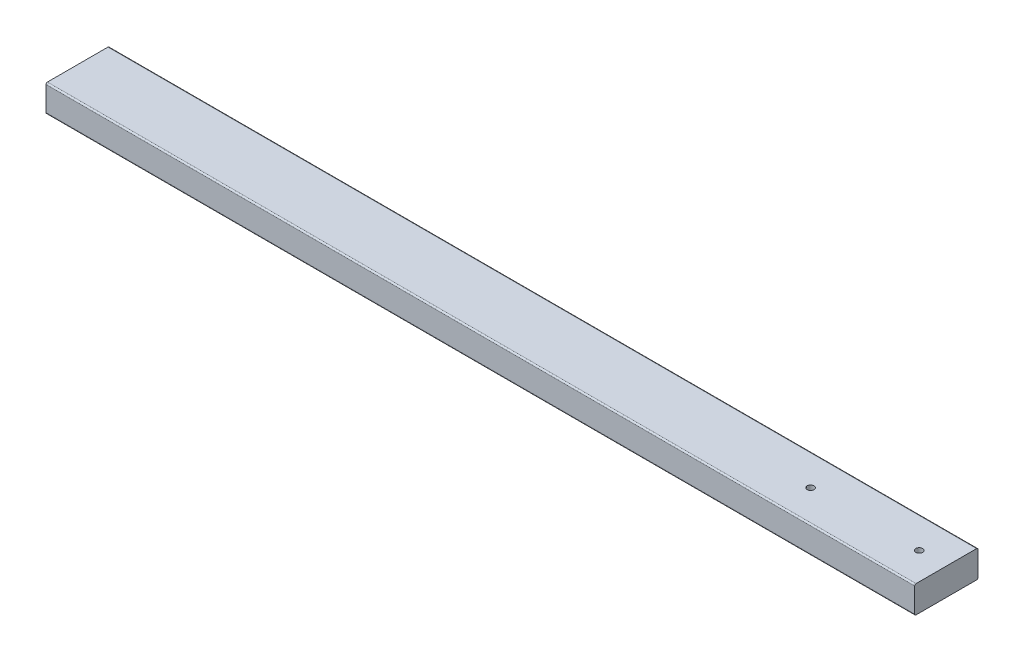
from build123d import *

# Parameters (mm, degrees)
SKETCH1_W           = 88.9
SKETCH1_H           = 38.1
BOSS_EXTRUDE1_DEPTH = 1219.2
FILLET1_R           = 2
SKETCH2_R           = 4.7625
CUT_EXTRUDE1_DEPTH  = 1221.604789643


with BuildPart() as part:
    # Sketch1 → Boss-Extrude1 (new body)
    with BuildSketch(Plane(origin=(0, 609.6, 0), x_dir=(0, 0, -1), z_dir=(1, 0, 0))):
        with Locations((0, -609.6)):
            Rectangle(SKETCH1_W, SKETCH1_H)
    extrude(amount=BOSS_EXTRUDE1_DEPTH)

    # Fillet1
    fillet1_edges = [part.edges().sort_by_distance(p)[0] for p in [
        (609.6, -19.05, -44.45),
        (609.6, -19.05, 44.45),
        (609.6, 19.05, 44.45),
        (609.6, 19.05, -44.45),
    ]]
    fillet(fillet1_edges, radius=FILLET1_R)

    # Sketch2 → Cut-Extrude1 (cut, through all)
    with BuildSketch(Plane(origin=(0, -19.05, 0), x_dir=(-1, 0, 0), z_dir=(0, -1, 0))):
        with Locations(Location((-1028.7, 0, 0), (0, 0, 90))):
            Circle(SKETCH2_R)
        with Locations(Location((-1181.1, 0, 0), (0, 0, 90))):
            Circle(SKETCH2_R)
    extrude(amount=-CUT_EXTRUDE1_DEPTH, mode=Mode.SUBTRACT)


solid = part.part
